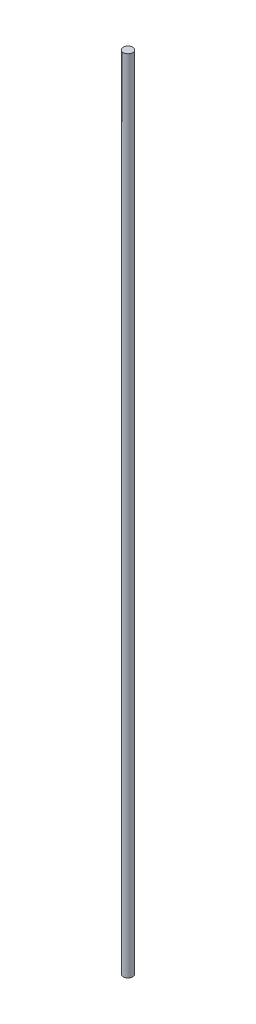
from build123d import *

# Parameters (mm, degrees)
SKETCH_1_R      = 0.5
EXTRUDE_1_DEPTH = 84


with BuildPart() as part:
    # 草图1 → 凸台-拉伸1 (new body)
    with BuildSketch(Plane(origin=(0, 0, 0), x_dir=(1, 0, 0), z_dir=(0, 1, 0))):
        with Locations(Location((0, 0, 0), (0, 0, 270))):
            Circle(SKETCH_1_R)
    extrude(amount=EXTRUDE_1_DEPTH)


solid = part.part
